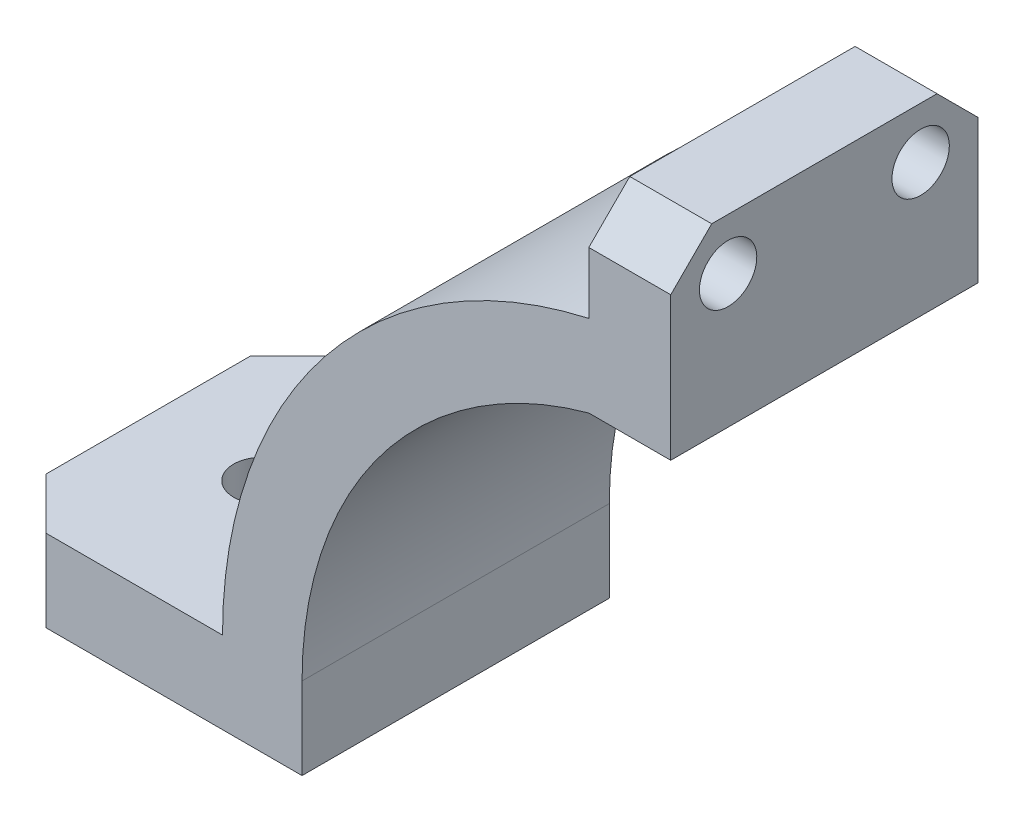
from build123d import *

# Parameters (mm, degrees)
BOSS_EXTRUDE1_DEPTH = 15
CHAMFER1_SIZE       = 2.5
SKETCH2_R           = 1.4
CUT_EXTRUDE1_DEPTH  = 15
CHAMFER2_SIZE       = 2
SKETCH3_R           = 1.4
CUT_EXTRUDE2_DEPTH  = 47.129659115


with BuildPart() as part:
    # Sketch1 → Boss-Extrude1 (new body)
    with BuildSketch(Plane.XY):
        with BuildLine():
            Line((-19, 0), (-19, -4))
            Line((-19, -4), (-34, -4))
            Line((-34, -4), (-34, 0))
            Line((-34, 0), (-22.883234523, 0))
            ThreePointArc((-22.883234523, 0), (-17.861391251, 14.304304416), (-5, 22.33030278))
            Line((-5, 22.33030278), (-5, 27.33030278))
            Line((-5, 27.33030278), (-1, 27.33030278))
            Line((-1, 27.33030278), (-1, 18.33030278))
            Line((-1, 18.33030278), (-5, 18.33030278))
            ThreePointArc((-5, 18.33030278), (-15.099668871, 11.532562595), (-19, 0))
        make_face()
    extrude(amount=BOSS_EXTRUDE1_DEPTH)

    # Chamfer1
    chamfer1_edges = [part.edges().sort_by_distance(p)[0] for p in [
        (-34, -2, 0),
        (-34, -2, 15),
    ]]
    chamfer(chamfer1_edges, length=CHAMFER1_SIZE)

    # Sketch2 → Cut-Extrude1 (cut)
    with BuildSketch(Plane.ZY.offset(5)):
        with Locations(Location((2.8, 24.83030278, 0), (0, 0, 270))):
            Circle(SKETCH2_R)
        with Locations(Location((12.2, 24.83030278, 0), (0, 0, 270))):
            Circle(SKETCH2_R)
    extrude(amount=-CUT_EXTRUDE1_DEPTH, mode=Mode.SUBTRACT)

    # Chamfer2
    chamfer2_edges = [part.edges().sort_by_distance(p)[0] for p in [
        (-3, 27.33030278, 0),
        (-3, 27.33030278, 15),
    ]]
    chamfer(chamfer2_edges, length=CHAMFER2_SIZE)

    # Sketch3 → Cut-Extrude2 (cut, through all)
    with BuildSketch(Plane(origin=(0, 0, 0), x_dir=(1, 0, 0), z_dir=(0, 1, 0))):
        with Locations(Location((-28.441617262, -7.5, 0), (0, 0, 270))):
            Circle(SKETCH3_R)
    extrude(amount=-CUT_EXTRUDE2_DEPTH, mode=Mode.SUBTRACT)


solid = part.part
